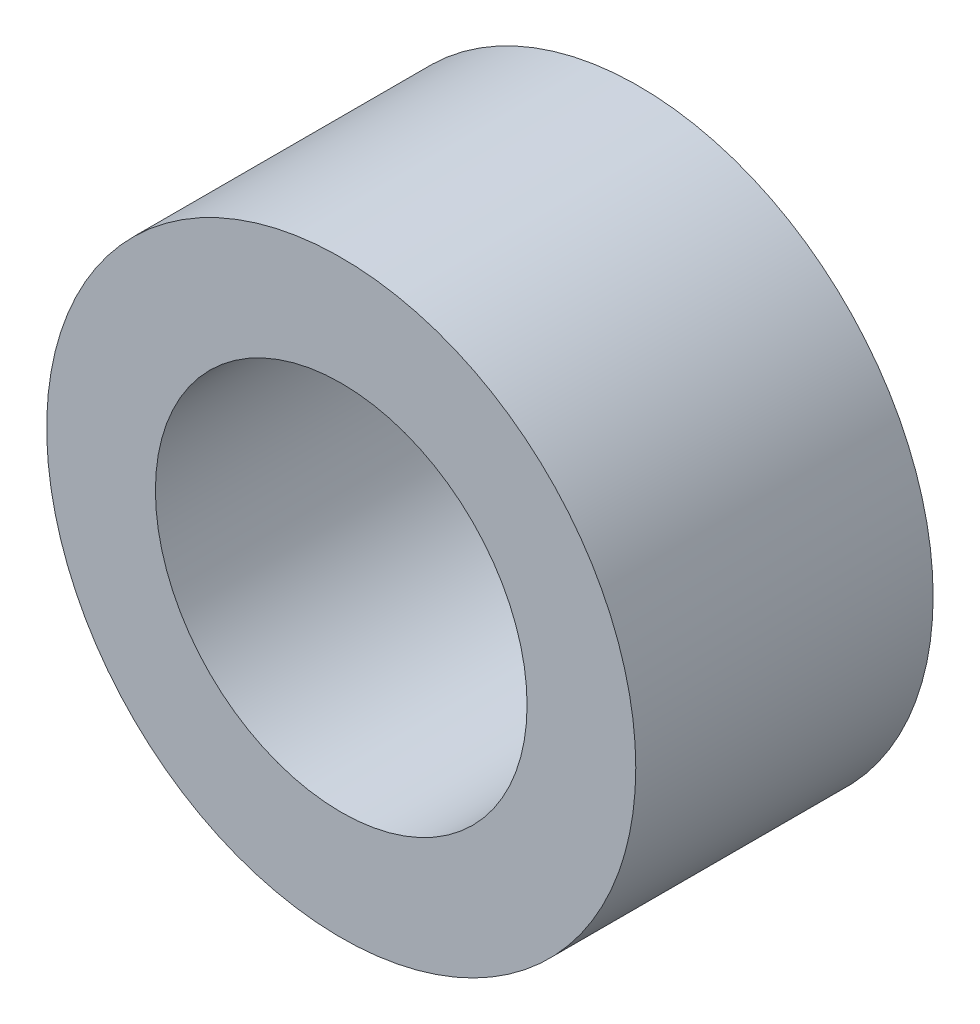
from build123d import *

# Parameters (mm, degrees)
SKETCH1_R           = 3.9624
SKETCH1_R_2         = 2.5
BOSS_EXTRUDE1_DEPTH = 4


with BuildPart() as part:
    # Sketch1 → Boss-Extrude1 (new body)
    with BuildSketch(Plane.XY):
        Circle(SKETCH1_R)
        Circle(SKETCH1_R_2, mode=Mode.SUBTRACT)
    extrude(amount=BOSS_EXTRUDE1_DEPTH)


solid = part.part
